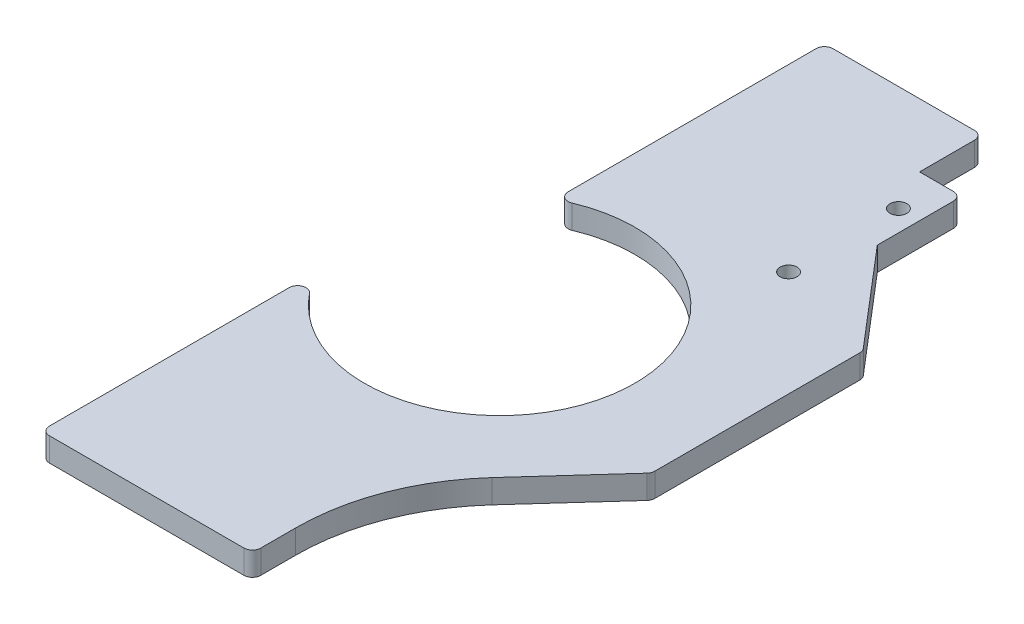
from build123d import *

# Parameters (mm, degrees)
SKETCH_1_R      = 2
EXTRUDE_1_DEPTH = 5.6
FILLET_1_R      = 2
FILLET_2_R      = 2
FILLET_3_R      = 50


with BuildPart() as part:
    # ｽｹｯﾁ1 → ﾎﾞｽ - 押し出し1 (new body)
    with BuildSketch(Plane(origin=(0, 0, 0), x_dir=(1, 0, 0), z_dir=(0, 1, 0))):
        with BuildLine():
            Line((47.5, -35), (67.5, -58.4))
            Line((67.5, -58.4), (67.5, -108.4))
            Line((67.5, -108.4), (36.64, -142.480487319))
            Line((36.64, -142.480487319), (36.64, -172))
            Line((36.64, -172), (-13.36, -172))
            Line((-13.36, -172), (-13.36, -106.551632211))
            ThreePointArc((-13.36, -106.551632211), (45.682817739, -101.546532593), (0, -63.808150114))
            Line((0, -63.808150114), (0, 0))
            Line((0, 0), (37.5, 0))
            Line((37.5, 0), (37.5, -15))
            Line((37.5, -15), (47.5, -15))
            Line((47.5, -15), (47.5, -35))
        make_face()
        with Locations(Location((42.5, -25, 0), (0, 0, 270))):
            Circle(SKETCH_1_R, mode=Mode.SUBTRACT)
        with Locations(Location((42.5, -51, 0), (0, 0, 270))):
            Circle(SKETCH_1_R, mode=Mode.SUBTRACT)
    extrude(amount=EXTRUDE_1_DEPTH)

    # ﾌｨﾚｯﾄ1
    fillet_1_edges = [part.edges().sort_by_distance(p)[0] for p in [
        (-13.36, 2.8, 106.551632211),
        (0, 2.8, 63.808150114),
    ]]
    fillet(fillet_1_edges, radius=FILLET_1_R)

    # ﾌｨﾚｯﾄ2
    fillet_2_edges = [part.edges().sort_by_distance(p)[0] for p in [
        (0, 2.8, 0),
        (37.5, 2.8, 0),
        (47.5, 2.8, 15),
        (67.5, 2.8, 58.4),
        (67.5, 2.8, 108.4),
        (36.64, 2.8, 172),
        (-13.36, 2.8, 172),
    ]]
    fillet(fillet_2_edges, radius=FILLET_2_R)

    # ﾌｨﾚｯﾄ3
    fillet_3_edges = [part.edges().sort_by_distance(p)[0] for p in [
        (36.64, 2.8, 142.480487319),
    ]]
    fillet(fillet_3_edges, radius=FILLET_3_R)


solid = part.part
